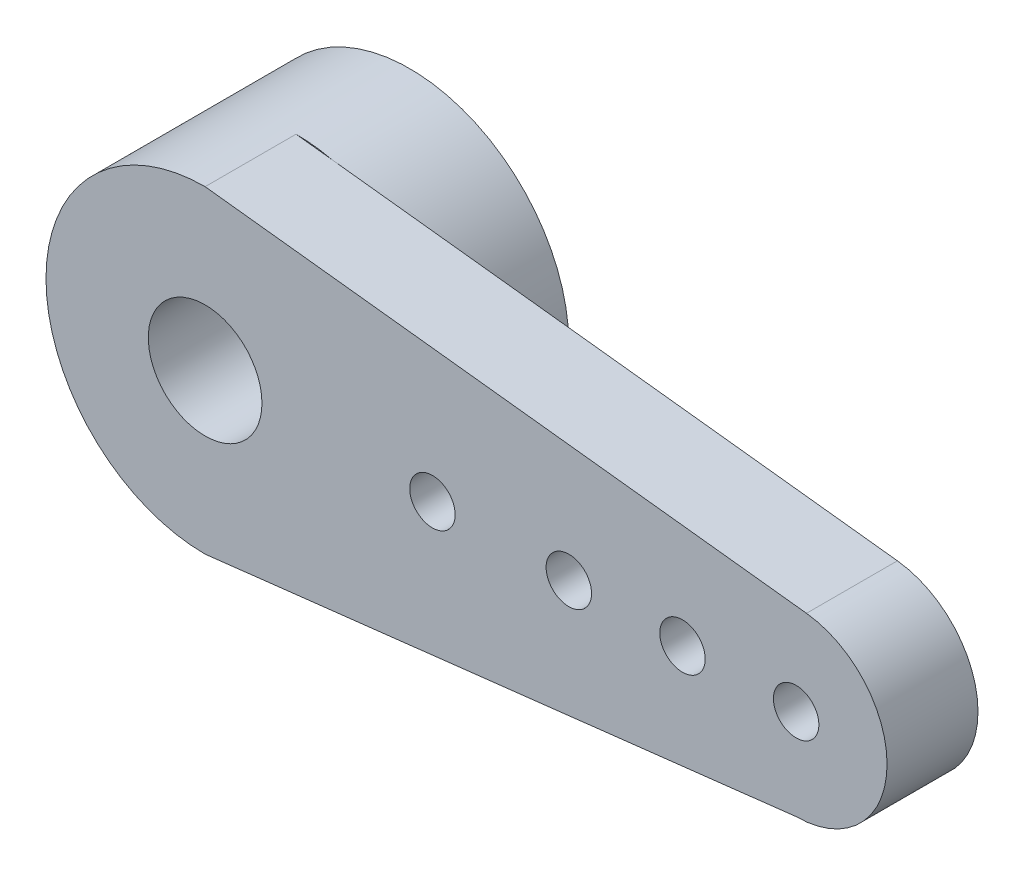
from build123d import *

# Parameters (mm, degrees)
SKETCH_1_R          = 1.25
SKETCH_1_R_2        = 0.5
EXTRUDE_1_DEPTH     = 2
CUT_EXTRUDE_1_REACH = 17.532
SKETCH_2_R          = 0.5
EXTRUDE_START       = 2.5
SKETCH_3_R          = 3.5
SKETCH_3_R_2        = 2.5
EXTRUDE_2_DEPTH     = 2.5


with BuildPart() as part:
    # 草圖1 → 填料-伸長1 (new body)
    with BuildSketch(Plane.XY):
        with BuildLine():
            Line((0, 3.5), (13.227281041, 1.987043867))
            ThreePointArc((13.227281041, 1.987043867), (14.99675834, -0.113825012), (13, -2))
            Line((13, -2), (0, -3.5))
            ThreePointArc((0, -3.5), (-3.5, 0), (0, 3.5))
        make_face()
        Circle(SKETCH_1_R, mode=Mode.SUBTRACT)
        with Locations((13, 0)):
            Circle(SKETCH_1_R_2, mode=Mode.SUBTRACT)
    extrude(amount=EXTRUDE_1_DEPTH)

    # 草圖2 → 除料-伸長1 (cut, up to next)
    with BuildSketch(Plane.XY.offset(2), mode=Mode.PRIVATE) as cut_extrude_1_sk1:
        with Locations((10.5, 0)):
            Circle(SKETCH_2_R)
    cut_extrude_1_tool1 = extrude(cut_extrude_1_sk1.sketch, amount=-CUT_EXTRUDE_1_REACH, mode=Mode.PRIVATE) & part.part
    # 草圖2 → 除料-伸長1 (cut, up to next)
    with BuildSketch(Plane.XY.offset(2), mode=Mode.PRIVATE) as cut_extrude_1_sk2:
        with Locations((8, 0)):
            Circle(SKETCH_2_R)
    cut_extrude_1_tool2 = extrude(cut_extrude_1_sk2.sketch, amount=-CUT_EXTRUDE_1_REACH, mode=Mode.PRIVATE) & part.part
    # 草圖2 → 除料-伸長1 (cut, up to next)
    with BuildSketch(Plane.XY.offset(2), mode=Mode.PRIVATE) as cut_extrude_1_sk3:
        with Locations((5, 0)):
            Circle(SKETCH_2_R)
    cut_extrude_1_tool3 = extrude(cut_extrude_1_sk3.sketch, amount=-CUT_EXTRUDE_1_REACH, mode=Mode.PRIVATE) & part.part
    add(cut_extrude_1_tool1.solids().sort_by_distance((10.5, 0, 2))[0], mode=Mode.SUBTRACT)
    add(cut_extrude_1_tool2.solids().sort_by_distance((8, 0, 2))[0], mode=Mode.SUBTRACT)
    add(cut_extrude_1_tool3.solids().sort_by_distance((5, 0, 2))[0], mode=Mode.SUBTRACT)

    # 草圖3 → 填料-伸長2 (add)
    with BuildSketch(Plane(origin=(0, 0, 0), x_dir=(-1, 0, 0), z_dir=(0, 0, -1)).offset(EXTRUDE_START)):
        Circle(SKETCH_3_R)
        Circle(SKETCH_3_R_2, mode=Mode.SUBTRACT)
    extrude(amount=-EXTRUDE_2_DEPTH)


solid = part.part
